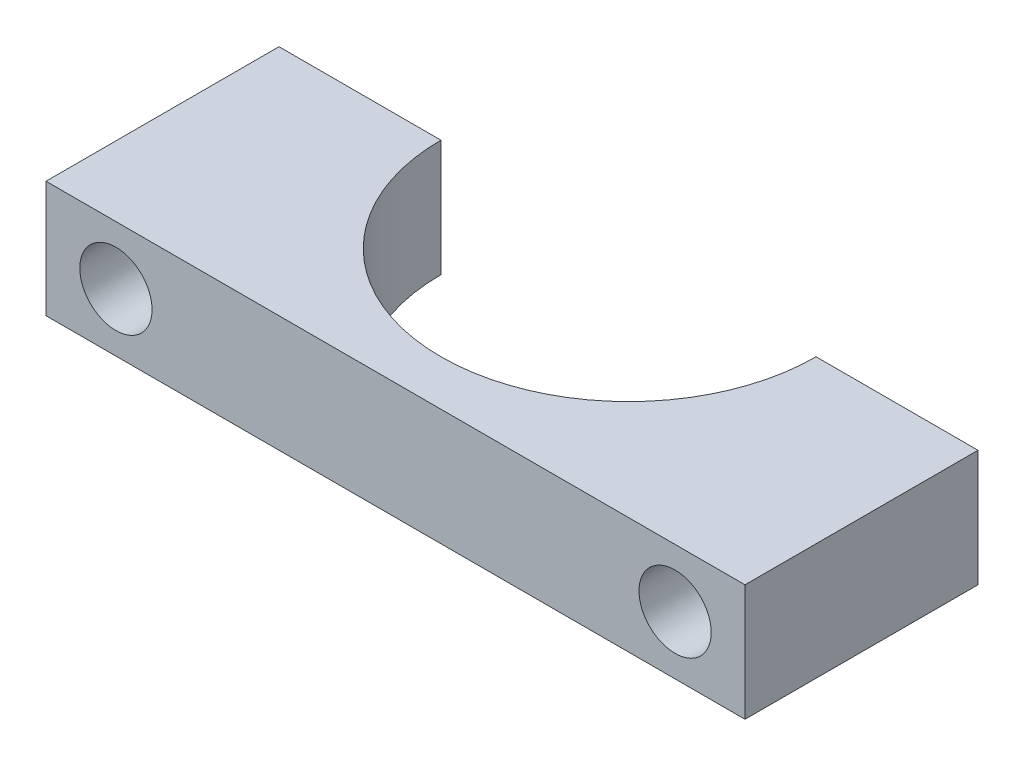
from build123d import *

# Parameters (mm, degrees)
BOSS_EXTRUDE1_DEPTH = 10
SKETCH2_R           = 3.1
CUT_EXTRUDE1_DEPTH  = 38.416573868


with BuildPart() as part:
    # Sketch1 → Boss-Extrude1 (new body)
    with BuildSketch(Plane(origin=(0, 0, 0), x_dir=(1, 0, 0), z_dir=(0, 1, 0))):
        with BuildLine():
            Line((16.1, 0), (30, 0))
            Line((30, 0), (30, -20))
            Line((30, -20), (-30, -20))
            Line((-30, -20), (-30, 0))
            Line((-30, 0), (-16.1, 0))
            ThreePointArc((-16.1, 0), (0, -16.1), (16.1, 0))
        make_face()
    extrude(amount=BOSS_EXTRUDE1_DEPTH)

    # Sketch2 → Cut-Extrude1 (cut, through all)
    with BuildSketch(Plane.XY.offset(20)):
        with Locations((-24, 5)):
            Circle(SKETCH2_R)
        with Locations((24, 5)):
            Circle(SKETCH2_R)
    extrude(amount=-CUT_EXTRUDE1_DEPTH, mode=Mode.SUBTRACT)


solid = part.part
